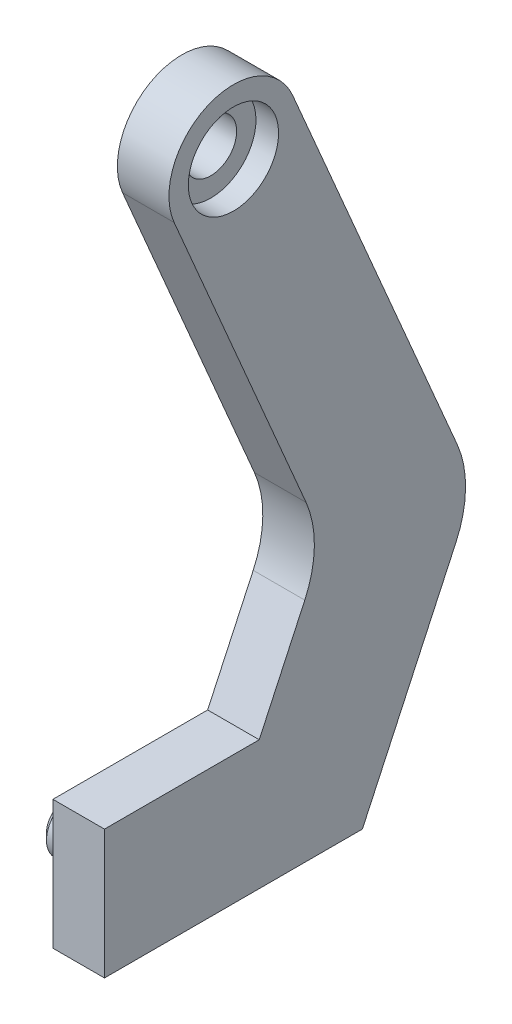
from build123d import *

# Parameters (mm, degrees)
BOSS_EXTRUDE1_DEPTH      = 88.9
CUT_EXTRUDE2_DEPTH       = 241.232341963
CUT_EXTRUDE2_DEPTH_BACK  = 241.232341963
SKETCH3_R                = 28.575
CUT_EXTRUDE5_DEPTH       = 28.575
CUT_EXTRUDE6_DEPTH       = 243.134084755
CUT_EXTRUDE6_DEPTH_BACK  = 243.134084755
SKETCH4_R                = 12.7
CUT_EXTRUDE7_DEPTH       = 261.369359036
CUT_EXTRUDE7_DEPTH_BACK  = 261.369359036
CUT_EXTRUDE8_DEPTH       = 261.369359036
CUT_EXTRUDE8_DEPTH_BACK  = 12.7
SKETCH6_R                = 6.35
SKETCH7_R                = 6.35
CUT_EXTRUDE9_DEPTH       = 12.7
SKETCH12_R               = 12.7
CUT_EXTRUDE13_DEPTH      = 3.175
CUT_EXTRUDE14_DEPTH      = 158.75
CUT_EXTRUDE14_DEPTH_BACK = 253.187753717
CUT_EXTRUDE14_START      = -12.7
SKETCH14_R               = 1.5875
CUT_EXTRUDE15_DEPTH      = 261.369359036
CUT_EXTRUDE15_DEPTH_BACK = 261.369359036
SKETCH15_W               = 158.75
SKETCH15_H               = 174.625
SKETCH17_R               = 6.35
BOSS_EXTRUDE3_DEPTH      = 9.525
CHAMFER2_SIZE            = 1.5875
CUT_EXTRUDE16_DEPTH      = 198.208141947
CUT_EXTRUDE16_DEPTH_BACK = 5.5626
SKETCH18_R               = 11.1125


with BuildPart() as part:
    # Sketch1 → Boss-Extrude1 (new body)
    with BuildSketch(Plane.XY):
        Polygon((0, 0), (0, -174.625), (171.45, -174.625), (171.45, 0), (158.75, 0), (158.75, -142.875), (12.7, -142.875), (12.7, 0), align=None)
    extrude(amount=BOSS_EXTRUDE1_DEPTH)

    # Sketch2 → Cut-Extrude2 (cut, two sides: drawn at the far end of the back side and taken through both)
    with BuildSketch(Plane(origin=(0, -142.875, 0), x_dir=(1, 0, 0), z_dir=(0, 1, 0)).offset(-CUT_EXTRUDE2_DEPTH_BACK)):
        Polygon((158.75, 0), (12.7, 0), (12.7, -25.4), (85.724999876, -25.4), (158.75, -25.4), align=None)
    extrude(amount=CUT_EXTRUDE2_DEPTH + CUT_EXTRUDE2_DEPTH_BACK, mode=Mode.SUBTRACT)

    # Sketch3 → Cut-Extrude5 (cut)
    with BuildSketch(Plane.XZ.offset(174.625)):
        with Locations((85.725, 57.15)):
            Circle(SKETCH3_R)
    extrude(amount=-CUT_EXTRUDE5_DEPTH, mode=Mode.SUBTRACT)

    # Sketch4 → Cut-Extrude6 (cut, two sides: drawn at the far end of the back side and taken through both)
    with BuildSketch(Plane.XZ.offset(146.05).offset(-CUT_EXTRUDE6_DEPTH_BACK)):
        with Locations((85.725, 57.15)):
            Circle(SKETCH4_R)
    extrude(amount=CUT_EXTRUDE6_DEPTH + CUT_EXTRUDE6_DEPTH_BACK, mode=Mode.SUBTRACT)

    # Sketch5 → Cut-Extrude7 (cut, two sides: drawn at the far end of the back side and taken through both)
    with BuildSketch(Plane(origin=(171.45, 0, 0), x_dir=(0, 0, -1), z_dir=(1, 0, 0)).offset(-CUT_EXTRUDE7_DEPTH_BACK)):
        with BuildLine():
            Line((0, -174.625), (0, -114.3))
            ThreePointArc((0, -114.3), (-0.597344099, -119.776153781), (-2.361280333, -124.994736842))
            Line((-2.361280333, -124.994736842), (-25.4, -174.625))
            Line((-25.4, -174.625), (0, -174.625))
        make_face()
        with BuildLine():
            Line((-39.269490456, -98.025866748), (-71.745289975, -22.119448379))
            ThreePointArc((-71.745289975, -22.119448379), (-70.400400796, -7.131859618), (-57.149999966, 0))
            Line((-57.149999966, 0), (-88.9, 0))
            Line((-88.9, 0), (-88.9, -142.875))
            Line((-88.9, -142.875), (-50.8, -142.875))
            Line((-50.8, -142.875), (-39.583234749, -118.711720996))
            ThreePointArc((-39.583234749, -118.711720996), (-37.224875429, -108.402184034), (-39.269490456, -98.025866748))
        make_face()
        with BuildLine():
            Line((0, 0), (-57.149999966, 0))
            ThreePointArc((-57.149999966, 0), (-48.406859618, -2.624599204), (-42.554710025, -9.630551621))
            Line((-42.554710025, -9.630551621), (-2.047536041, -104.308882594))
            ThreePointArc((-2.047536041, -104.308882594), (-0.51714863, -109.200616928), (0, -114.3))
            Line((0, -114.3), (0, 0))
        make_face()
    extrude(amount=CUT_EXTRUDE7_DEPTH + CUT_EXTRUDE7_DEPTH_BACK, mode=Mode.SUBTRACT)

    # Sketch6 → Cut-Extrude8 (cut, two sides: drawn at the far end of the back side and taken through both)
    with BuildSketch(Plane(origin=(171.45, 0, 0), x_dir=(0, 0, -1), z_dir=(1, 0, 0)).offset(-CUT_EXTRUDE8_DEPTH_BACK)):
        with Locations(Location((-57.15, -15.875, 0), (0, 0, 90))):
            Circle(SKETCH6_R)
    extrude(amount=CUT_EXTRUDE8_DEPTH + CUT_EXTRUDE8_DEPTH_BACK, mode=Mode.SUBTRACT)

    # Sketch7 → Cut-Extrude9 (cut)
    with BuildSketch(Plane(origin=(12.7, 0, 0), x_dir=(0, 0, -1), z_dir=(1, 0, 0))):
        with Locations(Location((-57.15, -15.875, 0), (0, 0, 90))):
            Circle(SKETCH7_R)
    extrude(amount=-CUT_EXTRUDE9_DEPTH, mode=Mode.SUBTRACT)

    # Sketch12 → Cut-Extrude13 (cut)
    with BuildSketch(Plane(origin=(12.7, 0, 0), x_dir=(0, 0, -1), z_dir=(1, 0, 0))):
        with Locations((-57.15, -15.875)):
            Circle(SKETCH12_R)
    extrude(amount=-CUT_EXTRUDE13_DEPTH, mode=Mode.SUBTRACT)

    # Sketch14 → Cut-Extrude14 (cut, two sides: drawn at the far end of the back side and taken through both)
    with BuildSketch(Plane(origin=(12.7, 0, 0), x_dir=(0, 0, -1), z_dir=(1, 0, 0)).offset(CUT_EXTRUDE14_START - CUT_EXTRUDE14_DEPTH_BACK)):
        with Locations(Location((-53.770765225, -24.780413934, 0), (0, 0, 90))):
            Circle(SKETCH14_R)
        with Locations(Location((-66.551932086, -14.348796194, 0), (0, 0, 90))):
            Circle(SKETCH14_R)
        with Locations(Location((-51.12730269, -8.495789872, 0), (0, 0, 90))):
            Circle(SKETCH14_R)
    extrude(amount=CUT_EXTRUDE14_DEPTH + CUT_EXTRUDE14_DEPTH_BACK, mode=Mode.SUBTRACT)

    # Sketch15 → Cut-Extrude15 (cut, two sides: drawn at the far end of the back side and taken through both)
    with BuildSketch(Plane.XY.offset(88.9).offset(-CUT_EXTRUDE15_DEPTH_BACK)):
        with Locations((79.375, -87.3125)):
            Rectangle(SKETCH15_W, SKETCH15_H)
    extrude(amount=CUT_EXTRUDE15_DEPTH + CUT_EXTRUDE15_DEPTH_BACK, mode=Mode.SUBTRACT)

    # Sketch17 → Boss-Extrude3 (add)
    with BuildSketch(Plane.ZY.offset(-158.75)):
        with Locations(Location((76.2, -158.75, 0), (0, 0, 90))):
            Circle(SKETCH17_R)
        with Locations(Location((38.1, -158.75, 0), (0, 0, 90))):
            Circle(SKETCH17_R)
    extrude(amount=BOSS_EXTRUDE3_DEPTH)

    # Chamfer2
    chamfer2_edges = [part.edges().sort_by_distance(p)[0] for p in [
        (149.225, -165.1, 76.2),
        (149.225, -165.1, 38.1),
    ]]
    chamfer(chamfer2_edges, length=CHAMFER2_SIZE)

    # Sketch18 → Cut-Extrude16 (cut, two sides: drawn at the far end of the back side and taken through both)
    with BuildSketch(Plane(origin=(171.45, 0, 0), x_dir=(0, 0, -1), z_dir=(1, 0, 0)).offset(-CUT_EXTRUDE16_DEPTH_BACK)):
        with Locations(Location((-57.15, -15.875, 0), (0, 0, 270))):
            Circle(SKETCH18_R)
    extrude(amount=CUT_EXTRUDE16_DEPTH + CUT_EXTRUDE16_DEPTH_BACK, mode=Mode.SUBTRACT)


solid = part.part
